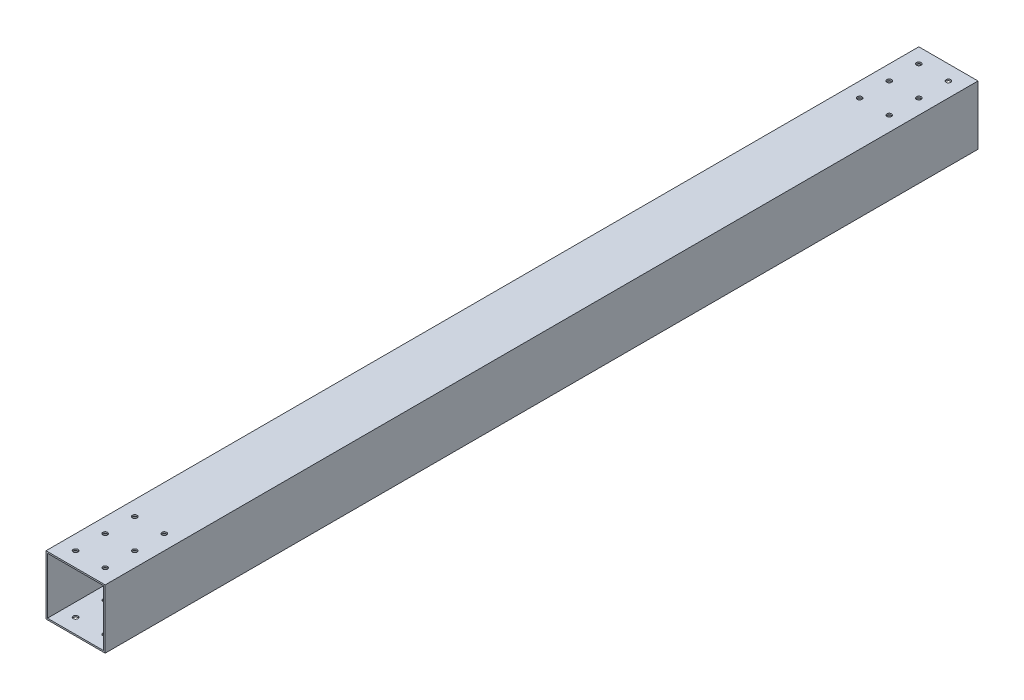
from build123d import *

# Parameters (mm, degrees)
SKETCH_1_W          = 40
SKETCH_1_H          = 40
SKETCH_1_W_2        = 38
SKETCH_1_H_2        = 38
EXTRUDE_1_DEPTH     = 295
SKETCH_3_R          = 1.6
CUT_EXTRUDE_2_DEPTH = 60


with BuildPart() as part:
    # 草图1 → 凸台-拉伸1 (new, symmetric)
    with BuildSketch(Plane.XY):
        Rectangle(SKETCH_1_W, SKETCH_1_H)
        Rectangle(SKETCH_1_W_2, SKETCH_1_H_2, mode=Mode.SUBTRACT)
    extrude(amount=EXTRUDE_1_DEPTH, both=True)

    # 草图3 → 切除-拉伸2 (cut)
    with BuildSketch(Plane(origin=(0, 20, 0), x_dir=(1, 0, 0), z_dir=(0, 1, 0))):
        with Locations(Location((-10, 245, 0), (0, 0, 270))):
            Circle(SKETCH_3_R)
        with Locations(Location((10, 245, 0), (0, 0, 270))):
            Circle(SKETCH_3_R)
        with Locations(Location((10, 265, 0), (0, 0, 270))):
            Circle(SKETCH_3_R)
        with Locations(Location((-10, 265, 0), (0, 0, 270))):
            Circle(SKETCH_3_R)
        with Locations(Location((-10, 285, 0), (0, 0, 270))):
            Circle(SKETCH_3_R)
        with Locations(Location((10, 285, 0), (0, 0, 270))):
            Circle(SKETCH_3_R)
        with Locations(Location((10, -285, 0), (0, 0, 270))):
            Circle(SKETCH_3_R)
        with Locations(Location((-10, -285, 0), (0, 0, 270))):
            Circle(SKETCH_3_R)
        with Locations(Location((-10, -265, 0), (0, 0, 270))):
            Circle(SKETCH_3_R)
        with Locations(Location((10, -265, 0), (0, 0, 270))):
            Circle(SKETCH_3_R)
        with Locations(Location((10, -245, 0), (0, 0, 270))):
            Circle(SKETCH_3_R)
        with Locations(Location((-10, -245, 0), (0, 0, 270))):
            Circle(SKETCH_3_R)
    extrude(amount=-CUT_EXTRUDE_2_DEPTH, mode=Mode.SUBTRACT)


solid = part.part
